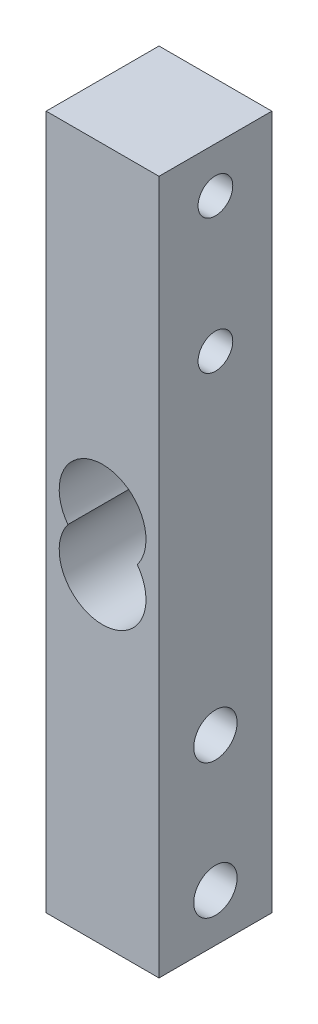
from build123d import *

# Parameters (mm, degrees)
SKETCH1_W           = 13
SKETCH1_H           = 13
BOSS_EXTRUDE1_DEPTH = 80
CUT_EXTRUDE1_DEPTH  = 13
SKETCH3_R           = 2
SKETCH3_R_2         = 2.5
CUT_EXTRUDE2_DEPTH  = 13


with BuildPart() as part:
    # Sketch1 → Boss-Extrude1 (new body)
    with BuildSketch(Plane(origin=(0, 0, 0), x_dir=(1, 0, 0), z_dir=(0, 1, 0))):
        Rectangle(SKETCH1_W, SKETCH1_H)
    extrude(amount=BOSS_EXTRUDE1_DEPTH)

    # Sketch2 → Cut-Extrude1 (cut)
    with BuildSketch(Plane.XY.offset(6.5)):
        with BuildLine():
            ThreePointArc((-4, 40), (0, 32), (4, 40))
            ThreePointArc((4, 40), (0, 48), (-4, 40))
        make_face()
    extrude(amount=-CUT_EXTRUDE1_DEPTH, mode=Mode.SUBTRACT)

    # Sketch3 → Cut-Extrude2 (cut)
    with BuildSketch(Plane(origin=(6.5, 0, 0), x_dir=(0, 0, -1), z_dir=(1, 0, 0))):
        with Locations((0, 74.8)):
            Circle(SKETCH3_R)
        with Locations((0, 59.3)):
            Circle(SKETCH3_R)
        with Locations((0, 21)):
            Circle(SKETCH3_R_2)
        with Locations((0, 5.5)):
            Circle(SKETCH3_R_2)
    extrude(amount=-CUT_EXTRUDE2_DEPTH, mode=Mode.SUBTRACT)


solid = part.part
